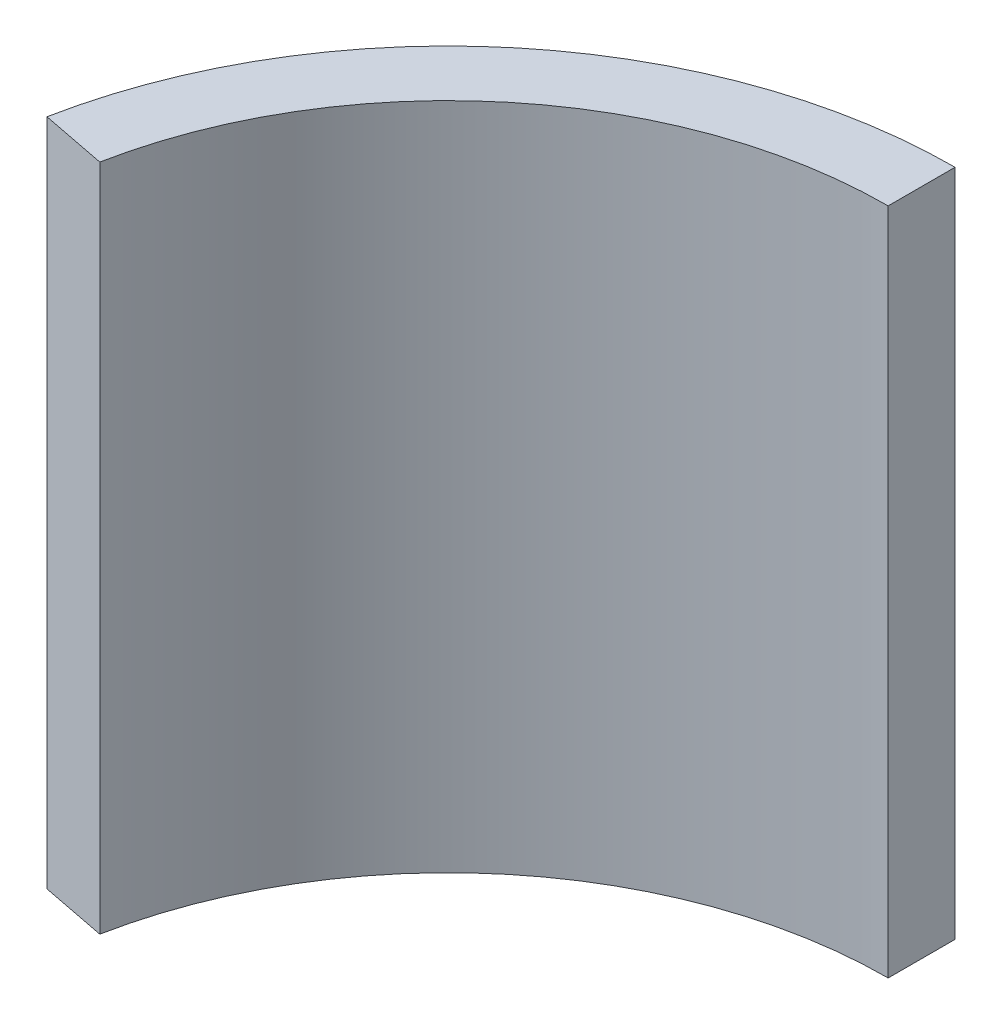
from build123d import *

# Parameters (mm, degrees)
REVOLVESKETCH_W       = 2.4
REVOLVESKETCH_H       = 24
THINBOSSREVOLVE_ANGLE = 79


with BuildPart() as part:
    # RevolveSketch → ThinBossRevolve (revolve)
    with BuildSketch(Plane(origin=(0, 0, 0), x_dir=(0, 0, -1), z_dir=(1, 0, 0))):
        with Locations((11, 3)):
            Rectangle(REVOLVESKETCH_W, REVOLVESKETCH_H)
    revolve(axis=Axis((0, -18, 6), (0, 1, 0)), revolution_arc=THINBOSSREVOLVE_ANGLE)


solid = part.part
